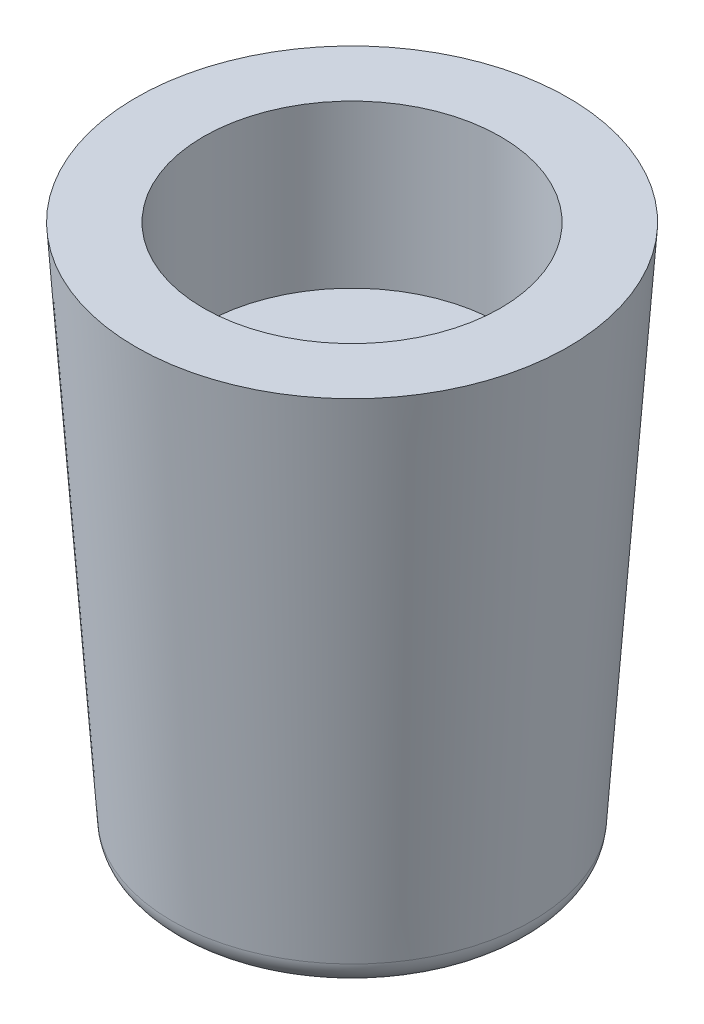
from build123d import *

# Parameters (mm, degrees)
SKETCH1_R               = 4
BOSS_EXTRUDE1_DEPTH     = 10
BOSS_EXTRUDE1_DRAFT     = -4
SKETCH2_R               = 2.75
BOSS_EXTRUDE2_DEPTH     = 3
CUT_EXTRUDE1_DEPTH      = 12.489125293
CUT_EXTRUDE1_DEPTH_BACK = 3
SKETCH2_3_R             = 2.75
FILLET1_R               = 0.5


with BuildPart() as part:
    # Sketch1 → Boss-Extrude1 (with draft: the straight prism first)
    with BuildSketch(Plane(origin=(0, 0, 0), x_dir=(1, 0, 0), z_dir=(0, 1, 0))):
        Circle(SKETCH1_R)
    extrude(amount=-BOSS_EXTRUDE1_DEPTH)
    # Boss-Extrude1: the draft: its side faces are tilted about the plane it starts from
    boss_extrude1_sides = [part.faces().sort_by_distance(p)[0] for p in [
        (-4, -5, 0),
    ]]
    draft(boss_extrude1_sides, Plane(origin=(0, 0, 0), x_dir=(1, 0, 0), z_dir=(0, 1, 0)), BOSS_EXTRUDE1_DRAFT)

    # Sketch2 → Boss-Extrude2 (add)
    with BuildSketch(Plane(origin=(0, 0, 0), x_dir=(1, 0, 0), z_dir=(0, 1, 0))):
        Circle(SKETCH2_R)
    extrude(amount=-BOSS_EXTRUDE2_DEPTH)

    # Sketch2<3> → Cut-Extrude1 (cut, two sides: drawn at the far end of the back side and taken through both)
    with BuildSketch(Plane(origin=(0, 0, 0), x_dir=(1, 0, 0), z_dir=(0, 1, 0)).offset(-CUT_EXTRUDE1_DEPTH_BACK)):
        Circle(SKETCH2_3_R)
    extrude(amount=CUT_EXTRUDE1_DEPTH + CUT_EXTRUDE1_DEPTH_BACK, mode=Mode.SUBTRACT)

    # Fillet1
    fillet1_edges = [part.edges().sort_by_distance(p)[0] for p in [
        (-3.300731881, -10, 0),
    ]]
    fillet(fillet1_edges, radius=FILLET1_R)


solid = part.part
